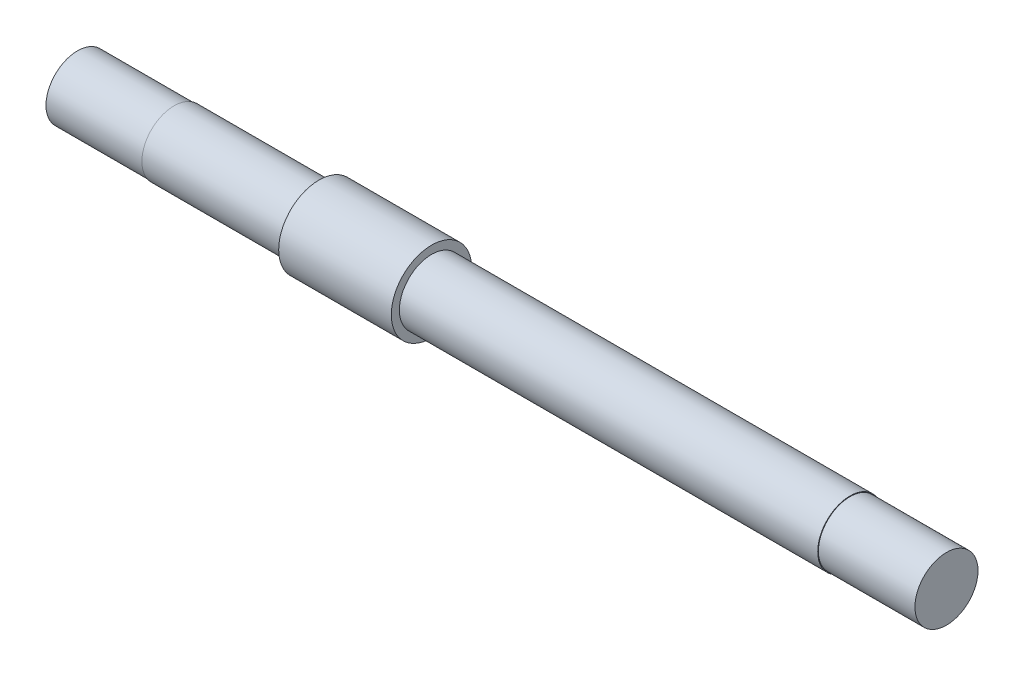
from build123d import *

# Parameters (mm, degrees)
SKETCH1_R           = 6.35
BOSS_EXTRUDE1_DEPTH = 15.875
SKETCH2_R           = 7.9375
BOSS_EXTRUDE2_DEPTH = 22.225
BOSS_EXTRUDE3_START = 69.85
SKETCH3_R           = 6.35
BOSS_EXTRUDE3_DEPTH = 69.85
SKETCH4_R           = 6.35
BOSS_EXTRUDE4_DEPTH = 47.625
SKETCH5_OUTSIDE_W   = 52.458
SKETCH5_OUTSIDE_H   = 52.458
SKETCH5_OUTSIDE_R   = 6.223
CUT_EXTRUDE3_DEPTH  = 19.05
SKETCH6_OUTSIDE_W   = 52.458
SKETCH6_OUTSIDE_H   = 52.458
SKETCH6_OUTSIDE_R   = 6.223
CUT_EXTRUDE4_DEPTH  = 19.05


with BuildPart() as part:
    # Sketch1 → Boss-Extrude1 (new, symmetric)
    with BuildSketch(Plane(origin=(0, 0, 0), x_dir=(0, 0, -1), z_dir=(1, 0, 0))):
        Circle(SKETCH1_R)
    extrude(amount=BOSS_EXTRUDE1_DEPTH, both=True)

    # Sketch2 → Boss-Extrude2 (add)
    with BuildSketch(Plane.ZY.offset(15.875)):
        Circle(SKETCH2_R)
    extrude(amount=BOSS_EXTRUDE2_DEPTH)

    # Sketch3 → Boss-Extrude3 (add)
    with BuildSketch(Plane(origin=(15.875, 0, 0), x_dir=(0, 0, -1), z_dir=(1, 0, 0)).offset(BOSS_EXTRUDE3_START)):
        with Locations(Location((0, 0, 0), (0, 0, 180))):
            Circle(SKETCH3_R)
    extrude(amount=-BOSS_EXTRUDE3_DEPTH)

    # Sketch4 → Boss-Extrude4 (add)
    with BuildSketch(Plane.ZY.offset(38.1)):
        Circle(SKETCH4_R)
    extrude(amount=BOSS_EXTRUDE4_DEPTH)

    # Sketch5 outside → Cut-Extrude3 (cut)
    with BuildSketch(Plane.ZY.offset(85.725)):
        Rectangle(SKETCH5_OUTSIDE_W, SKETCH5_OUTSIDE_H)
        Circle(SKETCH5_OUTSIDE_R, mode=Mode.SUBTRACT)
    extrude(amount=-CUT_EXTRUDE3_DEPTH, mode=Mode.SUBTRACT)

    # Sketch6 outside → Cut-Extrude4 (cut)
    with BuildSketch(Plane(origin=(85.725, 0, 0), x_dir=(0, 0, -1), z_dir=(1, 0, 0))):
        Rectangle(SKETCH6_OUTSIDE_W, SKETCH6_OUTSIDE_H)
        with Locations(Location((0, 0, 0), (0, 0, 180))):
            Circle(SKETCH6_OUTSIDE_R, mode=Mode.SUBTRACT)
    extrude(amount=-CUT_EXTRUDE4_DEPTH, mode=Mode.SUBTRACT)


solid = part.part
